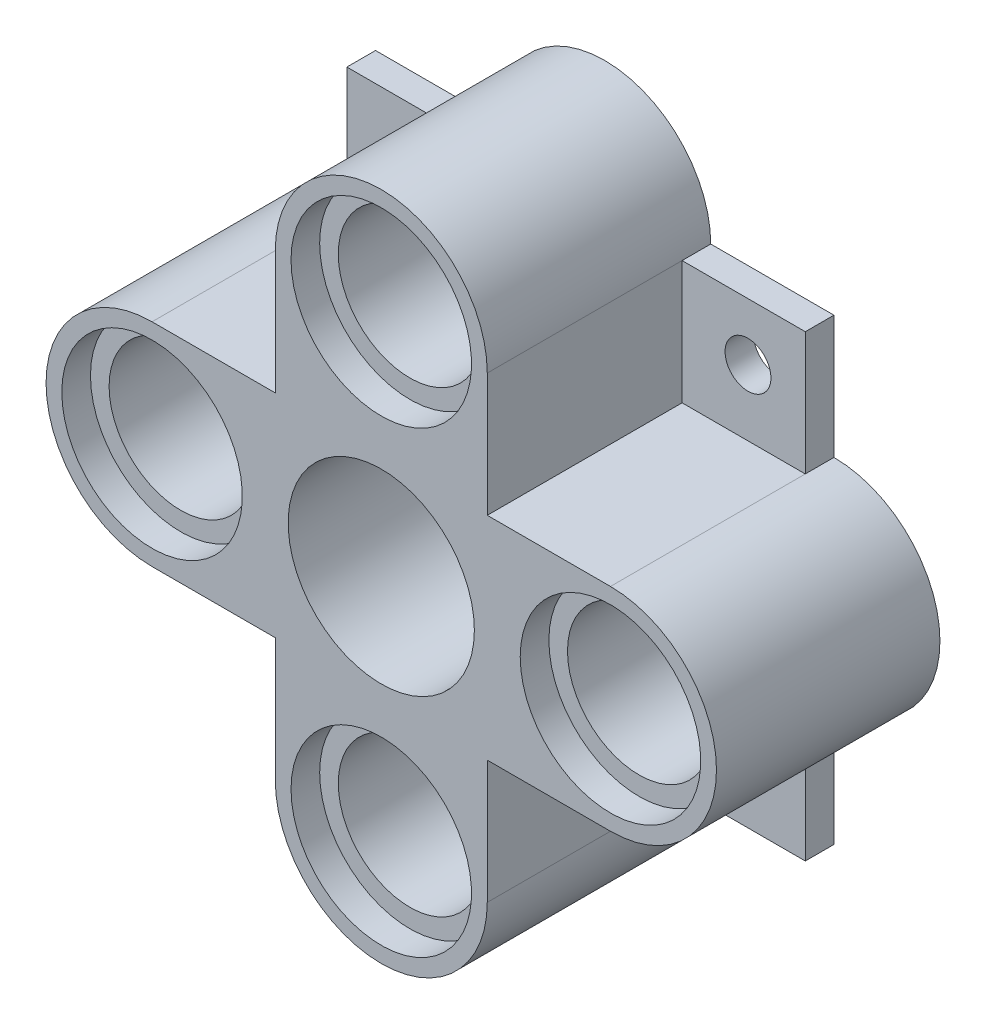
from build123d import *

# Parameters (mm, degrees)
SKETCH_2_W          = 23.4
SKETCH_2_H          = 7.4
SKETCH_2_W_2        = 7.4
SKETCH_2_H_2        = 23.4
EXTRUDE_1_DEPTH     = 7.8
SKETCH_3_W          = 16
SKETCH_3_H          = 16
EXTRUDE_2_DEPTH     = 1
SKETCH_2_6_R        = 2.5
SKETCH_2_6_R_2      = 3.25
CUT_EXTRUDE_3_DEPTH = 19.292621463
SKETCH_2_3_R        = 3.15
CUT_EXTRUDE_1_DEPTH = 1
CUT_EXTRUDE_START   = 6.8
SKETCH_2_5_R        = 3.15
CUT_EXTRUDE_2_DEPTH = 1
SKETCH_4_R          = 0.8
CUT_EXTRUDE_4_DEPTH = 18.889102828


with BuildPart() as part:
    # 草图2 → 凸台-拉伸1 (new body)
    with BuildSketch(Plane.XY):
        Rectangle(SKETCH_2_W, SKETCH_2_H)
        Rectangle(SKETCH_2_W_2, SKETCH_2_H_2)
    extrude(amount=EXTRUDE_1_DEPTH)

    # 草图3 → 凸台-拉伸2 (add)
    with BuildSketch(Plane(origin=(0, 0, 0), x_dir=(-1, 0, 0), z_dir=(0, 0, -1))):
        Rectangle(SKETCH_3_W, SKETCH_3_H)
    extrude(amount=-EXTRUDE_2_DEPTH)

    # 草图2<6> → 切除-拉伸3 (cut, through all)
    with BuildSketch(Plane.XY):
        with BuildLine():
            Line((-3.7, 11.7), (-3.7, 8))
            ThreePointArc((-3.7, 8), (-2.61629509, 10.61629509), (0, 11.7))
            Line((0, 11.7), (-3.7, 11.7))
        make_face()
        with BuildLine():
            ThreePointArc((0, 11.7), (2.61629509, 10.61629509), (3.7, 8))
            Line((3.7, 8), (3.7, 11.7))
            Line((3.7, 11.7), (0, 11.7))
        make_face()
        with BuildLine():
            Line((11.7, 3.7), (8.000000006, 3.7))
            ThreePointArc((8.000000006, 3.7), (10.616295093, 2.616295088), (11.7, 0))
            Line((11.7, 0), (11.7, 3.7))
        make_face()
        with BuildLine():
            ThreePointArc((11.7, 0), (10.616295085, -2.616295096), (7.999999984, -3.7))
            Line((7.999999984, -3.7), (11.7, -3.7))
            Line((11.7, -3.7), (11.7, 0))
        make_face()
        with BuildLine():
            Line((3.7, -11.7), (3.7, -8))
            ThreePointArc((3.7, -8), (2.61629509, -10.61629509), (0, -11.7))
            Line((0, -11.7), (3.7, -11.7))
        make_face()
        with BuildLine():
            ThreePointArc((0, -11.7), (-2.616295094, -10.616295087), (-3.7, -7.99999999))
            Line((-3.7, -7.99999999), (-3.7, -11.7))
            Line((-3.7, -11.7), (0, -11.7))
        make_face()
        with BuildLine():
            Line((-11.7, -1.1e-08), (-11.7, -3.7))
            Line((-11.7, -3.7), (-8.000000004, -3.7))
            ThreePointArc((-8.000000004, -3.7), (-10.616295088, -2.616295093), (-11.7, -1.1e-08))
        make_face()
        with BuildLine():
            Line((-11.7, 3.7), (-11.7, -1.1e-08))
            ThreePointArc((-11.7, -1.1e-08), (-10.616295094, 2.616295086), (-8, 3.7))
            Line((-8, 3.7), (-11.7, 3.7))
        make_face()
        with Locations((0, 8)):
            Circle(SKETCH_2_6_R)
        with Locations((-8, 0)):
            Circle(SKETCH_2_6_R)
        Circle(SKETCH_2_6_R_2)
        with Locations((8, 0)):
            Circle(SKETCH_2_6_R)
        with Locations((0, -8)):
            Circle(SKETCH_2_6_R)
    extrude(amount=CUT_EXTRUDE_3_DEPTH, mode=Mode.SUBTRACT)

    # 草图2<3> → 切除-拉伸1 (cut)
    with BuildSketch(Plane.XY):
        with Locations((8, 0)):
            Circle(SKETCH_2_3_R)
        with Locations((-8, 0)):
            Circle(SKETCH_2_3_R)
        with Locations((0, 8)):
            Circle(SKETCH_2_3_R)
        with Locations((0, -8)):
            Circle(SKETCH_2_3_R)
    extrude(amount=CUT_EXTRUDE_1_DEPTH, mode=Mode.SUBTRACT)

    # 草图2<5> → 切除-拉伸2 (cut)
    with BuildSketch(Plane.XY.offset(CUT_EXTRUDE_START)):
        with Locations((8, 0)):
            Circle(SKETCH_2_5_R)
        with Locations((-8, 0)):
            Circle(SKETCH_2_5_R)
        with Locations((0, 8)):
            Circle(SKETCH_2_5_R)
        with Locations((0, -8)):
            Circle(SKETCH_2_5_R)
    extrude(amount=CUT_EXTRUDE_2_DEPTH, mode=Mode.SUBTRACT)

    # 草图4 → 切除-拉伸4 (cut, through all)
    with BuildSketch(Plane.XY.offset(1)):
        with Locations((-6, 6)):
            Circle(SKETCH_4_R)
        with Locations((6, 6)):
            Circle(SKETCH_4_R)
        with Locations((-6, -6)):
            Circle(SKETCH_4_R)
        with Locations((6, -6)):
            Circle(SKETCH_4_R)
    extrude(amount=-CUT_EXTRUDE_4_DEPTH, mode=Mode.SUBTRACT)


solid = part.part
